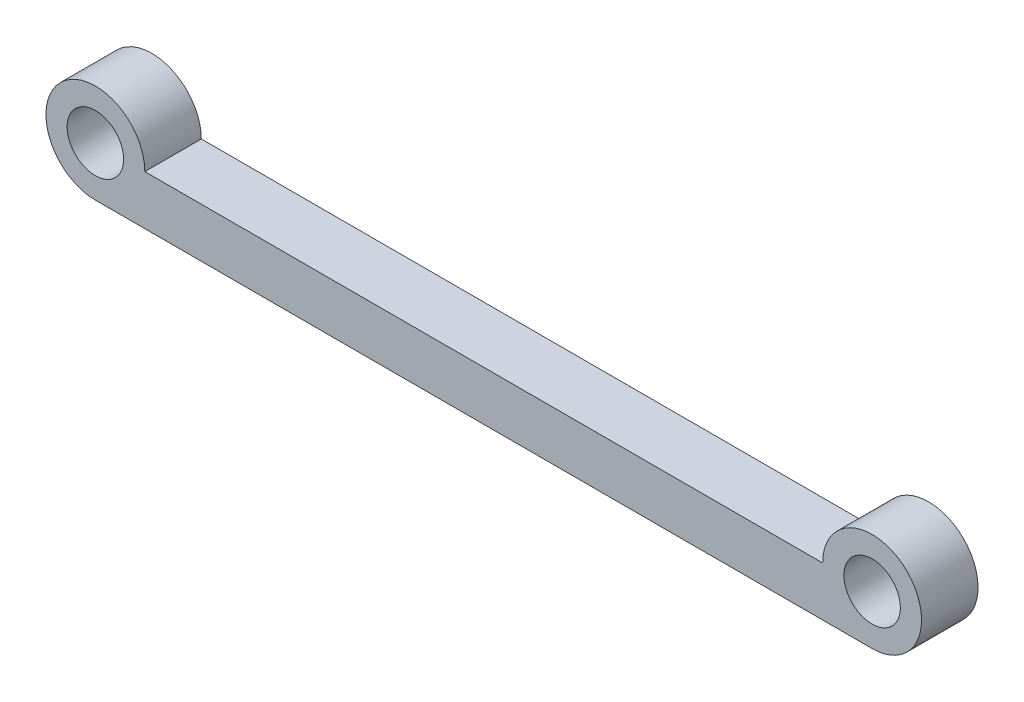
from build123d import *

# Parameters (mm, degrees)
SKETCH_1_R      = 2
EXTRUDE_1_DEPTH = 4


with BuildPart() as part:
    # ｽｹｯﾁ1 → ﾎﾞｽ - 押し出し1 (new body)
    with BuildSketch(Plane.XY):
        with BuildLine():
            Line((0, -3.5), (55, -3.5))
            ThreePointArc((55, -3.5), (57.474873734, 2.474873734), (51.5, 0))
            Line((51.5, 0), (3.5, 0))
            ThreePointArc((3.5, 0), (-2.474873734, 2.474873734), (0, -3.5))
        make_face()
        Circle(SKETCH_1_R, mode=Mode.SUBTRACT)
        with Locations((55, 0)):
            Circle(SKETCH_1_R, mode=Mode.SUBTRACT)
    extrude(amount=EXTRUDE_1_DEPTH)


solid = part.part
